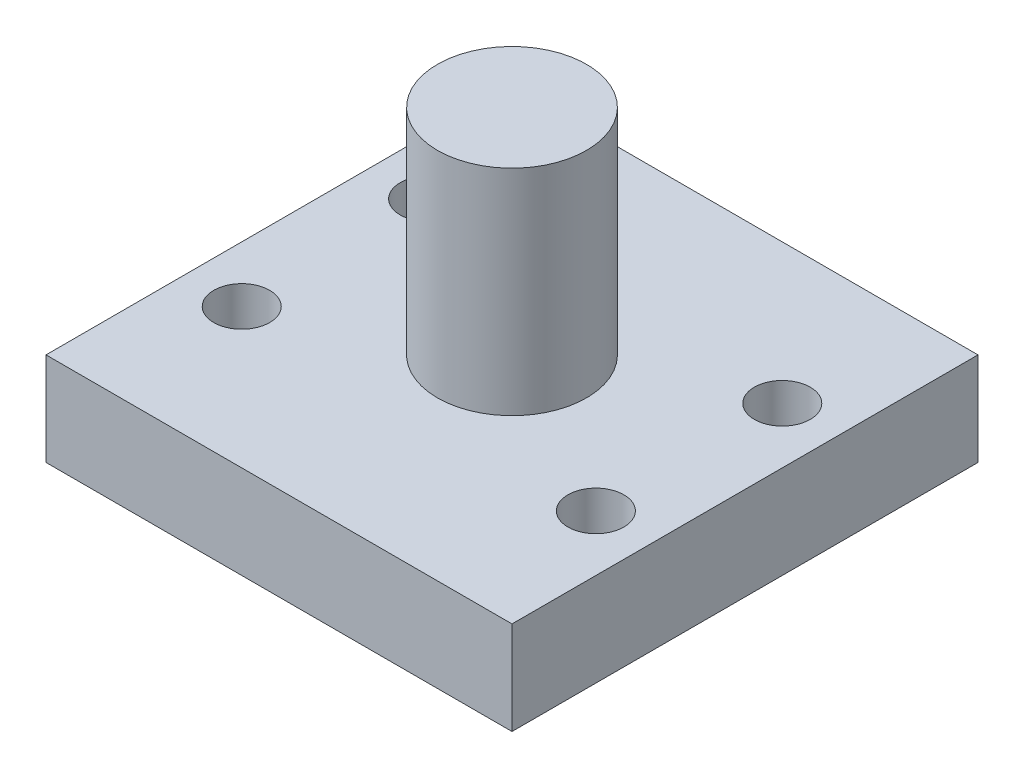
from build123d import *

# Parameters (mm, degrees)
SKETCH_1_R          = 4
EXTRUDE_1_DEPTH     = 11.5
SKETCH_3_W          = 25
SKETCH_3_H          = 25
EXTRUDE_2_DEPTH     = 5
SKETCH_4_R          = 1.5
CUT_EXTRUDE_2_DEPTH = 5


with BuildPart() as part:
    # 草图1 → 凸台-拉伸1 (new body)
    with BuildSketch(Plane(origin=(0, 0, 0), x_dir=(1, 0, 0), z_dir=(0, 1, 0))):
        with Locations(Location((0, 0, 0), (0, 0, 270))):
            Circle(SKETCH_1_R)
    extrude(amount=EXTRUDE_1_DEPTH)

    # 草图3 → 凸台-拉伸2 (add)
    with BuildSketch(Plane.XZ):
        Rectangle(SKETCH_3_W, SKETCH_3_H)
    extrude(amount=EXTRUDE_2_DEPTH)

    # 草图4 → 切除-拉伸2 (cut)
    with BuildSketch(Plane(origin=(0, 0, 0), x_dir=(1, 0, 0), z_dir=(0, 1, 0))):
        with Locations(Location((9.5, 5, 0), (0, 0, 270))):
            Circle(SKETCH_4_R)
        with Locations(Location((9.5, -5, 0), (0, 0, 270))):
            Circle(SKETCH_4_R)
        with Locations(Location((-9.5, -5, 0), (0, 0, 270))):
            Circle(SKETCH_4_R)
        with Locations(Location((-9.5, 5, 0), (0, 0, 270))):
            Circle(SKETCH_4_R)
    extrude(amount=-CUT_EXTRUDE_2_DEPTH, mode=Mode.SUBTRACT)


solid = part.part
